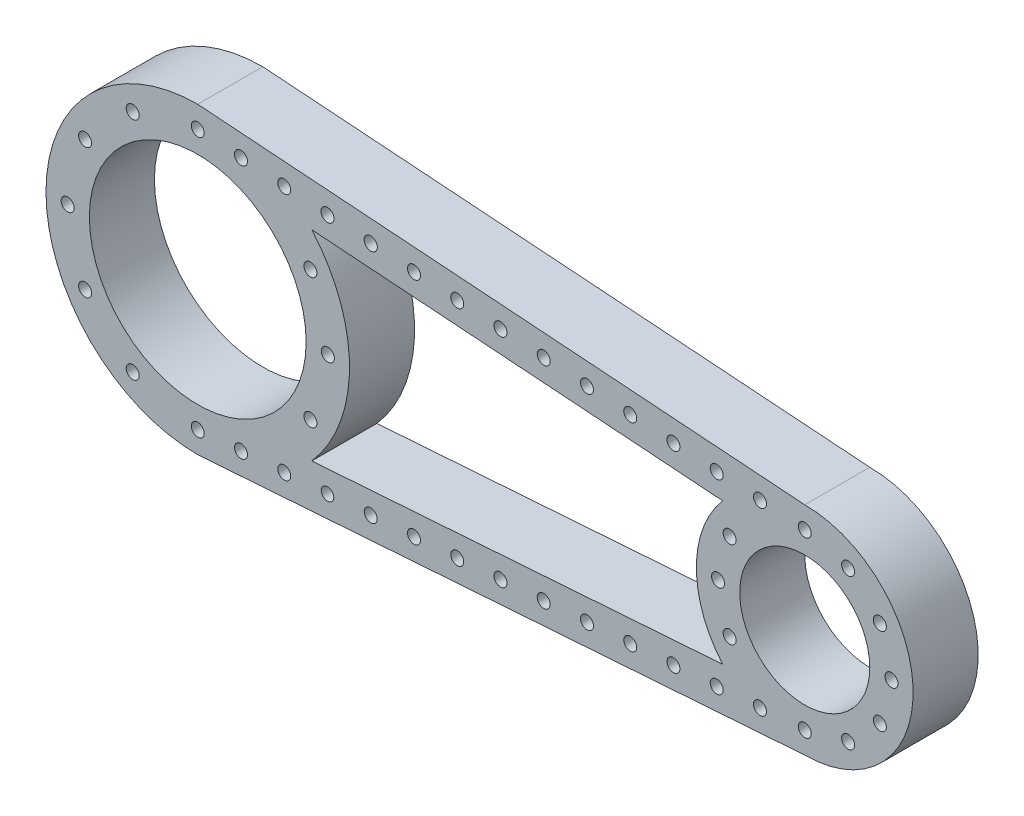
from build123d import *
from build123d.topology import SkipClean

# Parameters (mm, degrees)
EXTRUDE_3_DEPTH      = 5
SKETCH_4_R           = 4
SKETCH_4_R_2         = 1.5
CUT_EXTRUDE_3_DEPTH  = 5
SKETCH_5_R           = 11
CUT_EXTRUDE_4_DEPTH  = 2
SKETCH_6_R           = 1.5
CUT_EXTRUDE_6_DEPTH  = 169.745370307
SKETCH_8_R           = 1.5
CUT_EXTRUDE_8_DEPTH  = 169.745370307
SKETCH_10_R          = 25
SKETCH_10_R_2        = 15
CUT_EXTRUDE_9_DEPTH  = 169.745370307
EXTRUDE_START        = 10
SKETCH_11_R          = 25
SKETCH_11_R_2        = 15
EXTRUDE_4_DEPTH      = 10
SKETCH_13_R          = 1.5
SKETCH_13_R_2        = 1.522394956
SKETCH_13_R_3        = 1.446191393
CUT_EXTRUDE_10_DEPTH = 170.336942219


with BuildPart() as part:
    # 草图1 → 凸台-拉伸3 (new body)
    with BuildSketch(Plane.XY):
        with BuildLine():
            Line((140, 25), (0, 35))
            ThreePointArc((0, 35), (-35, 0), (0, -35))
            Line((0, -35), (140, -25))
            ThreePointArc((140, -25), (165, 0), (140, 25))
        make_face()
    extrude(amount=EXTRUDE_3_DEPTH)

    # 草图4 → 切除-拉伸3 (cut)
    with BuildSketch(Plane.XY.offset(5)):
        with Locations((140, 0)):
            Circle(SKETCH_4_R)
        Circle(SKETCH_4_R)
        with BuildLine():
            Line((-5, -3.5), (-5, -5))
            Line((-5, -5), (-3.5, -5))
            ThreePointArc((-3.5, -5), (-3.939339828, -3.939339828), (-5, -3.5))
        make_face()
        with BuildLine():
            Line((-3.5, -5), (-5, -5))
            Line((-5, -5), (-5, -3.5))
            ThreePointArc((-5, -3.5), (-6.060660172, -6.060660172), (-3.5, -5))
        make_face()
        with Locations((135, 5)):
            Circle(SKETCH_4_R_2)
        with Locations((135, -5)):
            Circle(SKETCH_4_R_2)
        with Locations((145, -5)):
            Circle(SKETCH_4_R_2)
        with Locations((145, 5)):
            Circle(SKETCH_4_R_2)
        with Locations((-5, 5)):
            Circle(SKETCH_4_R_2)
        with Locations((5, 5)):
            Circle(SKETCH_4_R_2)
        with Locations((5, -5)):
            Circle(SKETCH_4_R_2)
    extrude(amount=-CUT_EXTRUDE_3_DEPTH, mode=Mode.SUBTRACT)

    # 草图5 → 切除-拉伸4 (cut)
    with BuildSketch(Plane.XY.offset(5)):
        Circle(SKETCH_5_R)
        with Locations((140, 0)):
            Circle(SKETCH_5_R)
    extrude(amount=-CUT_EXTRUDE_4_DEPTH, mode=Mode.SUBTRACT)

    # 草图6 → 切除-拉伸6 (cut, through all)
    with BuildSketch(Plane.XY.offset(5)):
        with Locations((0, 30)):
            Circle(SKETCH_6_R)
        with Locations((15, 25.980762114)):
            Circle(SKETCH_6_R)
        with Locations((25.980762114, 15)):
            Circle(SKETCH_6_R)
        with Locations((30, 0)):
            Circle(SKETCH_6_R)
        with Locations((25.980762114, -15)):
            Circle(SKETCH_6_R)
        with Locations((15, -25.980762114)):
            Circle(SKETCH_6_R)
        with Locations((0, -30)):
            Circle(SKETCH_6_R)
        with Locations((-15, -25.980762114)):
            Circle(SKETCH_6_R)
        with Locations((-25.980762114, -15)):
            Circle(SKETCH_6_R)
        with Locations((-30, 0)):
            Circle(SKETCH_6_R)
        with Locations((-25.980762114, 15)):
            Circle(SKETCH_6_R)
        with Locations((-15, 25.980762114)):
            Circle(SKETCH_6_R)
        with Locations((140, 20)):
            Circle(SKETCH_6_R)
        with Locations((150, 17.320508076)):
            Circle(SKETCH_6_R)
        with Locations((157.320508076, 10)):
            Circle(SKETCH_6_R)
        with Locations((160, 0)):
            Circle(SKETCH_6_R)
        with Locations((157.320508076, -10)):
            Circle(SKETCH_6_R)
        with Locations((150, -17.320508076)):
            Circle(SKETCH_6_R)
        with Locations((140, -20)):
            Circle(SKETCH_6_R)
        with Locations((130, -17.320508076)):
            Circle(SKETCH_6_R)
        with Locations((122.679491924, -10)):
            Circle(SKETCH_6_R)
        with Locations((120, 0)):
            Circle(SKETCH_6_R)
        with Locations((122.679491924, 10)):
            Circle(SKETCH_6_R)
        with Locations((130, 17.320508076)):
            Circle(SKETCH_6_R)
    extrude(amount=-CUT_EXTRUDE_6_DEPTH, mode=Mode.SUBTRACT)

    # 草图8 → 切除-拉伸8 (cut, through all)
    with BuildSketch(Plane.XY.offset(5)):
        with BuildLine():
            ThreePointArc((35, 0), (32.752250408, -12.340587232), (26.297708958, -23.096114469))
            Line((26.297708958, -23.096114469), (121.06763386, -16.326834119))
            ThreePointArc((121.06763386, -16.326834119), (115, 0), (121.06763386, 16.326834119))
            Line((121.06763386, 16.326834119), (26.297708958, 23.096114469))
            ThreePointArc((26.297708958, 23.096114469), (32.752250408, 12.340587232), (35, 0))
        make_face()
        with BuildLine():
            ThreePointArc((41.39357706, -27.03057705), (39.791477418, -25.653929951), (38.401308325, -27.244310531))
            Line((38.401308325, -27.244310531), (41.39357706, -27.03057705))
        make_face()
        with BuildLine():
            Line((41.39357706, -27.03057705), (38.401308325, -27.244310531))
            ThreePointArc((38.401308325, -27.244310531), (39.945467513, -28.649377735), (41.398347993, -27.150118))
            ThreePointArc((41.398347993, -27.150118), (41.397154785, -27.090299942), (41.39357706, -27.03057705))
        make_face()
        with Locations((9.974586998, 29.2875295)):
            Circle(SKETCH_8_R)
        with Locations((19.949173997, 28.575059)):
            Circle(SKETCH_8_R)
        with Locations((29.923760995, 27.8625885)):
            Circle(SKETCH_8_R)
        with Locations((39.898347993, 27.150118)):
            Circle(SKETCH_8_R)
        with Locations((49.872934992, 26.437647501)):
            Circle(SKETCH_8_R)
        with Locations((59.84752199, 25.725177001)):
            Circle(SKETCH_8_R)
        with Locations((69.822108988, 25.012706501)):
            Circle(SKETCH_8_R)
        with Locations((89.771282985, 23.587765501)):
            Circle(SKETCH_8_R)
        with Locations((79.796695986, 24.300236001)):
            Circle(SKETCH_8_R)
        with Locations((99.745869983, 22.875295001)):
            Circle(SKETCH_8_R)
        with Locations((109.720456981, 22.162824501)):
            Circle(SKETCH_8_R)
        with Locations((119.69504398, 21.450354001)):
            Circle(SKETCH_8_R)
        with Locations((129.669630978, 20.737883502)):
            Circle(SKETCH_8_R)
        with Locations((129.669630978, -20.737883502)):
            Circle(SKETCH_8_R)
        with Locations((119.69504398, -21.450354001)):
            Circle(SKETCH_8_R)
        with Locations((109.720456981, -22.162824501)):
            Circle(SKETCH_8_R)
        with Locations((99.745869983, -22.875295001)):
            Circle(SKETCH_8_R)
        with Locations((89.771282985, -23.587765501)):
            Circle(SKETCH_8_R)
        with Locations((79.796695986, -24.300236001)):
            Circle(SKETCH_8_R)
        with Locations((69.822108988, -25.012706501)):
            Circle(SKETCH_8_R)
        with Locations((59.84752199, -25.725177001)):
            Circle(SKETCH_8_R)
        with Locations((49.872934992, -26.437647501)):
            Circle(SKETCH_8_R)
        with Locations((29.923760995, -27.8625885)):
            Circle(SKETCH_8_R)
        with Locations((19.949173997, -28.575059)):
            Circle(SKETCH_8_R)
        with Locations((9.974586998, -29.2875295)):
            Circle(SKETCH_8_R)
    extrude(amount=-CUT_EXTRUDE_8_DEPTH, mode=Mode.SUBTRACT)

    # 草图10 → 切除-拉伸9 (cut, through all)
    with BuildSketch(Plane.XY.offset(5)):
        Circle(SKETCH_10_R)
        with Locations((140, 0)):
            Circle(SKETCH_10_R_2)
    extrude(amount=-CUT_EXTRUDE_9_DEPTH, mode=Mode.SUBTRACT)

    # 草图11 → 凸台-拉伸4 (add)
    # profile 1 of 4: a face of its own
    with SkipClean():  # the faces are left unmerged after this step: merging them gives an invalid solid
        with BuildSketch(Plane.XY.offset(5).offset(EXTRUDE_START)):
            with Locations((140, 0)):
                Circle(SKETCH_11_R)
            with Locations((140, 0)):
                Circle(SKETCH_11_R_2, mode=Mode.SUBTRACT)
        # profile 2 of 4: a face of its own
        with BuildSketch(Plane.XY.offset(5).offset(EXTRUDE_START)):
            with BuildLine():
                ThreePointArc((121.06763386, 16.326834119), (129.587768082, 22.728515712), (140, 25))
                Line((140, 25), (4.974619289, 34.644670051))
                ThreePointArc((4.974619289, 34.644670051), (16.668290629, 30.77609604), (26.297708958, 23.096114469))
                Line((26.297708958, 23.096114469), (121.06763386, 16.326834119))
            make_face()
        # profile 3 of 4: a face of its own
        with BuildSketch(Plane.XY.offset(5).offset(EXTRUDE_START)):
            with BuildLine():
                Line((4.974619289, -34.644670051), (140, -25))
                ThreePointArc((140, -25), (129.587768082, -22.728515712), (121.06763386, -16.326834119))
                Line((121.06763386, -16.326834119), (26.297708958, -23.096114469))
                ThreePointArc((26.297708958, -23.096114469), (16.668290629, -30.77609604), (4.974619289, -34.644670051))
            make_face()
        # profile 4 of 4: a face of its own
        with BuildSketch(Plane.XY.offset(5).offset(EXTRUDE_START)):
            with BuildLine():
                ThreePointArc((26.297708958, 23.096114469), (16.668290629, 30.77609604), (4.974619289, 34.644670051))
                Line((4.974619289, 34.644670051), (0, 35))
                ThreePointArc((0, 35), (-35, 0), (0, -35))
                Line((0, -35), (4.974619289, -34.644670051))
                ThreePointArc((4.974619289, -34.644670051), (16.668290629, -30.77609604), (26.297708958, -23.096114469))
                ThreePointArc((26.297708958, -23.096114469), (32.752250408, -12.340587232), (35, 0))
                ThreePointArc((35, 0), (32.752250408, 12.340587232), (26.297708958, 23.096114469))
            make_face()
            Circle(SKETCH_11_R, mode=Mode.SUBTRACT)
        extrude(amount=-EXTRUDE_4_DEPTH)

    # 草图13 → 切除-拉伸10 (cut, through all)
    with SkipClean():  # the faces are left unmerged after this step: merging them gives an invalid solid
        with BuildSketch(Plane(origin=(0, 0, 0), x_dir=(-1, 0, 0), z_dir=(0, 0, -1))):
            with Locations(Location((-150, 17.320508076, 0), (0, 0, 180))):
                Circle(SKETCH_13_R)
            with Locations(Location((-157.320508076, 10, 0), (0, 0, 180))):
                Circle(SKETCH_13_R)
            with Locations(Location((-160, 0, 0), (0, 0, 180))):
                Circle(SKETCH_13_R)
            with Locations(Location((-157.320508076, -10, 0), (0, 0, 180))):
                Circle(SKETCH_13_R)
            with Locations(Location((-150, -17.320508076, 0), (0, 0, 180))):
                Circle(SKETCH_13_R)
            with Locations(Location((-140, -20, 0), (0, 0, 180))):
                Circle(SKETCH_13_R)
            with Locations(Location((-120, 0, 0), (0, 0, 180))):
                Circle(SKETCH_13_R)
            with Locations(Location((-122.679491924, 10, 0), (0, 0, 180))):
                Circle(SKETCH_13_R)
            with Locations(Location((-122.679491924, -10, 0), (0, 0, 180))):
                Circle(SKETCH_13_R)
            with Locations(Location((-129.669630978, -20.737883502, 0), (0, 0, 180))):
                Circle(SKETCH_13_R)
            with Locations(Location((-119.69504398, -21.450354001, 0), (0, 0, 180))):
                Circle(SKETCH_13_R)
            with Locations(Location((-109.720456981, -22.162824501, 0), (0, 0, 180))):
                Circle(SKETCH_13_R)
            with Locations(Location((-99.745869983, -22.875295001, 0), (0, 0, 180))):
                Circle(SKETCH_13_R)
            with Locations(Location((-140, 20, 0), (0, 0, 180))):
                Circle(SKETCH_13_R)
            with Locations(Location((-129.669630978, 20.737883502, 0), (0, 0, 180))):
                Circle(SKETCH_13_R)
            with Locations(Location((-119.69504398, 21.450354001, 0), (0, 0, 180))):
                Circle(SKETCH_13_R)
            with Locations(Location((-109.720456981, 22.162824501, 0), (0, 0, 180))):
                Circle(SKETCH_13_R)
            with Locations(Location((-99.745869983, 22.875295001, 0), (0, 0, 180))):
                Circle(SKETCH_13_R)
            with Locations(Location((-89.771282985, 23.587765501, 0), (0, 0, 180))):
                Circle(SKETCH_13_R)
            with Locations(Location((-79.796695986, 24.300236001, 0), (0, 0, 180))):
                Circle(SKETCH_13_R)
            with Locations(Location((-69.822108988, 25.012706501, 0), (0, 0, 180))):
                Circle(SKETCH_13_R)
            with Locations(Location((-59.84752199, 25.725177001, 0), (0, 0, 180))):
                Circle(SKETCH_13_R)
            with Locations(Location((-49.872934992, 26.437647501, 0), (0, 0, 180))):
                Circle(SKETCH_13_R)
            with Locations((-39.898347993, 27.150118)):
                Circle(SKETCH_13_R_2)
            with Locations(Location((-29.923760995, 27.8625885, 0), (0, 0, 180))):
                Circle(SKETCH_13_R)
            with Locations(Location((-19.949173997, 28.575059, 0), (0, 0, 180))):
                Circle(SKETCH_13_R)
            with Locations(Location((-9.974586998, 29.2875295, 0), (0, 0, 180))):
                Circle(SKETCH_13_R)
            with Locations(Location((0, 30, 0), (0, 0, 180))):
                Circle(SKETCH_13_R)
            with Locations(Location((15, 25.980762114, 0), (0, 0, 180))):
                Circle(SKETCH_13_R)
            with Locations(Location((25.980762114, 15, 0), (0, 0, 180))):
                Circle(SKETCH_13_R)
            with Locations(Location((30, 0, 0), (0, 0, 180))):
                Circle(SKETCH_13_R)
            with Locations(Location((25.980762114, -15, 0), (0, 0, 180))):
                Circle(SKETCH_13_R)
            with Locations(Location((15, -25.980762114, 0), (0, 0, 180))):
                Circle(SKETCH_13_R)
            with Locations(Location((0, -30, 0), (0, 0, 180))):
                Circle(SKETCH_13_R)
            with Locations(Location((-9.974586998, -29.2875295, 0), (0, 0, 180))):
                Circle(SKETCH_13_R)
            with Locations(Location((-19.949173997, -28.575059, 0), (0, 0, 180))):
                Circle(SKETCH_13_R)
            with Locations((-29.923760995, -27.8625885)):
                Circle(SKETCH_13_R_3)
            with Locations(Location((-39.898347993, -27.150118, 0), (0, 0, 180))):
                Circle(SKETCH_13_R)
            with Locations(Location((-49.872934992, -26.437647501, 0), (0, 0, 180))):
                Circle(SKETCH_13_R)
            with Locations(Location((-59.84752199, -25.725177001, 0), (0, 0, 180))):
                Circle(SKETCH_13_R)
            with Locations(Location((-69.822108988, -25.012706501, 0), (0, 0, 180))):
                Circle(SKETCH_13_R)
            with Locations(Location((-79.796695986, -24.300236001, 0), (0, 0, 180))):
                Circle(SKETCH_13_R)
            with Locations(Location((-89.771282985, -23.587765501, 0), (0, 0, 180))):
                Circle(SKETCH_13_R)
            with Locations(Location((-30, 0, 0), (0, 0, 180))):
                Circle(SKETCH_13_R)
            with Locations(Location((-25.980762114, -15, 0), (0, 0, 180))):
                Circle(SKETCH_13_R)
            with Locations(Location((-25.980762114, 15, 0), (0, 0, 180))):
                Circle(SKETCH_13_R)
        extrude(amount=-CUT_EXTRUDE_10_DEPTH, mode=Mode.SUBTRACT)


solid = part.part
